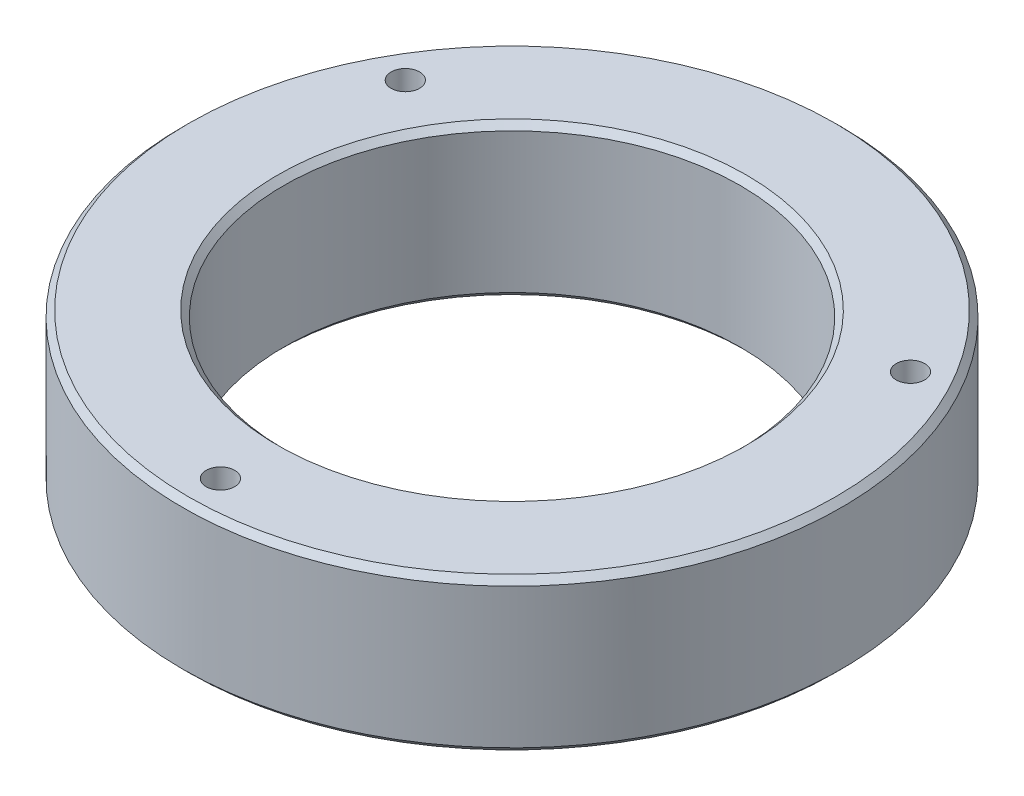
from build123d import *

# Parameters (mm, degrees)
SKETCH1_W                   = 38.1
SKETCH1_H                   = 25.3746
CUT_EXTRUDE2_START          = -19.05
SKETCH4_R                   = 3.5687
CUT_EXTRUDE2_DEPTH          = 138.301941677
CUT_EXTRUDE4_START          = -19.05
SKETCH5_R                   = 5.5626
CUT_EXTRUDE4_DEPTH          = 9.652
F_3_8_16_TAPPED_HOLE2_D     = 7.9375
F_3_8_16_TAPPED_HOLE2_DEPTH = 25.4
F_3_8_16_TAPPED_HOLE2_TIP   = 2.384665582
CHAMFER1_SIZE               = 1.524


with BuildPart() as part:
    # Sketch1 → Revolve1 (revolve)
    with BuildSketch(Plane(origin=(0, 0, 0), x_dir=(0, 1, 0), z_dir=(0, 0, 1)), mode=Mode.PRIVATE) as revolve1_sk:
        with Locations((0, 69.8373)):
            Rectangle(SKETCH1_W, SKETCH1_H)
    revolve(revolve1_sk.sketch.rotate(Axis((0, -44.45, 0), (0, 1, 0)), 270), axis=Axis((0, -44.45, 0), (0, 1, 0)))

    # Sketch4 → Cut-Extrude2 (cut, through all)
    with BuildSketch(Plane(origin=(0, 0, 0), x_dir=(-1, 0, 0), z_dir=(0, 1, 0)).offset(CUT_EXTRUDE2_START)):
        with Locations(Location((0, 73.025, 0), (0, 0, 270))):
            Circle(SKETCH4_R)
        with Locations(Location((-63.246, -36.5252, 0), (0, 0, 270))):
            Circle(SKETCH4_R)
        with Locations(Location((63.246, -36.5252, 0), (0, 0, 270))):
            Circle(SKETCH4_R)
    extrude(amount=CUT_EXTRUDE2_DEPTH, mode=Mode.SUBTRACT)

    # Sketch5 → Cut-Extrude4 (cut)
    with BuildSketch(Plane(origin=(0, 0, 0), x_dir=(-1, 0, 0), z_dir=(0, 1, 0)).offset(CUT_EXTRUDE4_START)):
        with Locations(Location((0, 73.025, 0), (0, 0, 90))):
            Circle(SKETCH5_R)
        with Locations(Location((-63.246, -36.5252, 0), (0, 0, 90))):
            Circle(SKETCH5_R)
        with Locations(Location((63.246, -36.5252, 0), (0, 0, 90))):
            Circle(SKETCH5_R)
    extrude(amount=CUT_EXTRUDE4_DEPTH, mode=Mode.SUBTRACT)

    # 3/8-16 Tapped Hole2
    with Locations(Plane(origin=(0, -19.05, 0), x_dir=(-1, 0, 0), z_dir=(0, -1, 0))):
        with Locations((-69.85, 0), (69.85, 0)):
            Hole(F_3_8_16_TAPPED_HOLE2_D / 2, depth=F_3_8_16_TAPPED_HOLE2_DEPTH)
            with Locations((0, 0, -(F_3_8_16_TAPPED_HOLE2_DEPTH + F_3_8_16_TAPPED_HOLE2_TIP / 2))):  # 118° drill point
                Cone(0, F_3_8_16_TAPPED_HOLE2_D / 2, F_3_8_16_TAPPED_HOLE2_TIP, mode=Mode.SUBTRACT)

    # Chamfer1
    chamfer1_edges = [part.edges().sort_by_distance(p)[0] for p in [
        (0, -19.05, 57.15),
        (0, 19.05, 57.15),
        (0, 19.05, 82.5246),
        (0, -19.05, 82.5246),
    ]]
    chamfer(chamfer1_edges, length=CHAMFER1_SIZE)


solid = part.part
